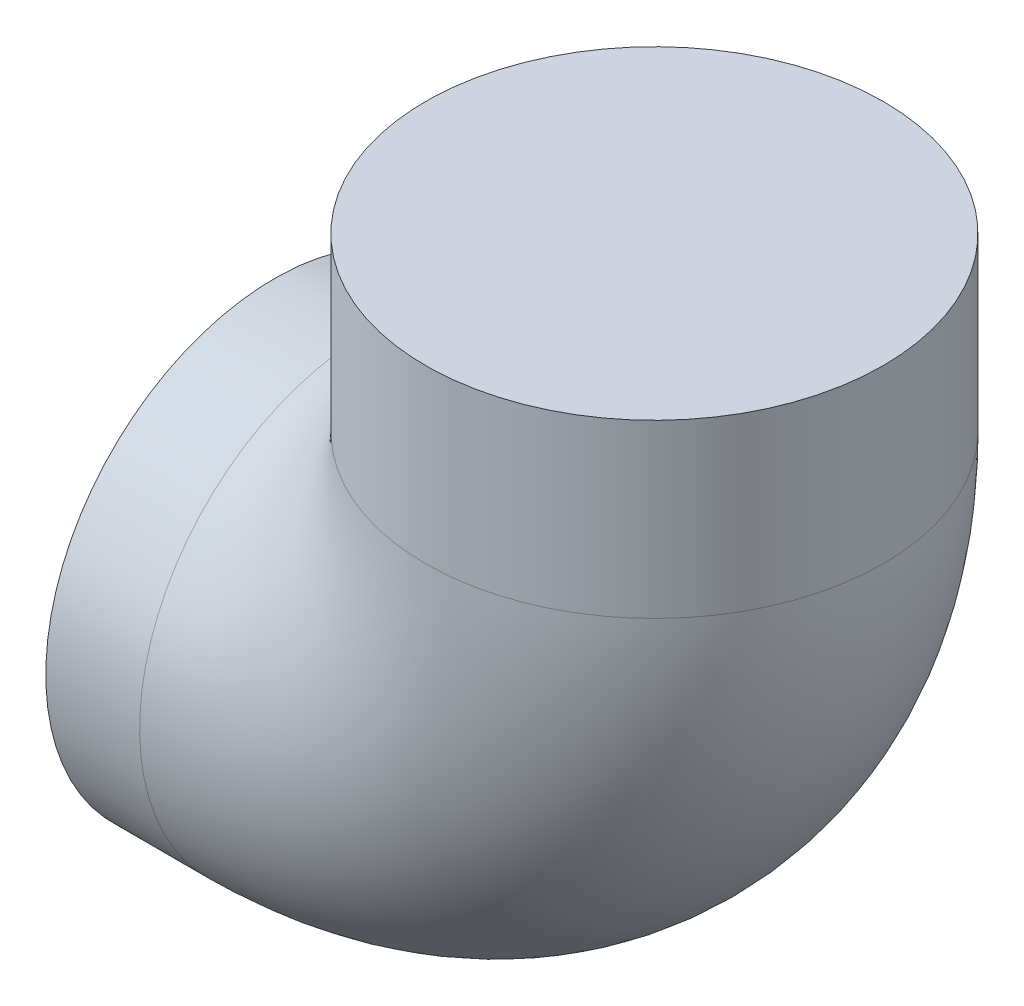
from build123d import *

# Parameters (mm, degrees)
SKETCH2_R = 20


with BuildPart() as part:
    # Sweep2: sweep along a path in Sketch1
    with BuildLine(Plane.XY) as sweep2_path:
        Line((0, 0), (8.2, 0))
        ThreePointArc((8.2, 0), (25.87766953, 7.32233047), (33.2, 25))
        Line((33.2, 25), (33.2, 40))
    # Sketch2 → Sweep2 (sweep)
    with BuildSketch(Plane(origin=(0, 0, 0), x_dir=(0, 0, -1), z_dir=(1, 0, 0))):
        Circle(SKETCH2_R)
    sweep(path=sweep2_path.line)


solid = part.part
